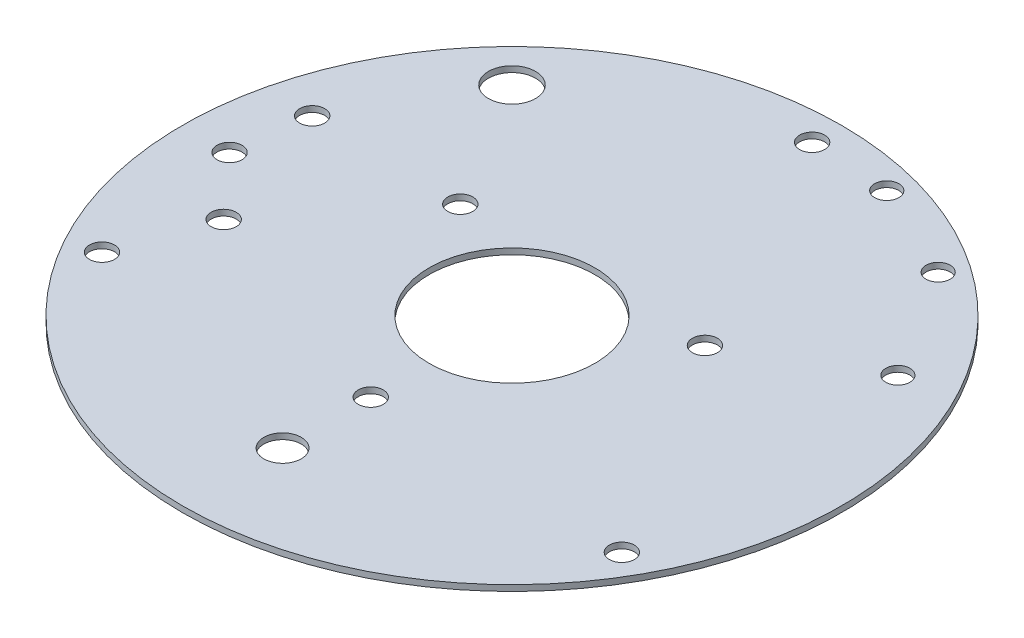
from build123d import *

# Parameters (mm, degrees)
SKETCH1_R           = 88.9
SKETCH1_R_2         = 22.352
SKETCH1_R_3         = 6.35
SKETCH1_R_4         = 5.0419
SKETCH1_R_5         = 3.3782
SKETCH1_R_6         = 3.2639
BOSS_EXTRUDE1_DEPTH = 1.6002


with BuildPart() as part:
    # Sketch1 → Boss-Extrude1 (new body)
    with BuildSketch(Plane(origin=(0, 0, 0), x_dir=(1, 0, 0), z_dir=(0, 1, 0))):
        with Locations(Location((0, 0, 0), (0, 0, 270))):
            Circle(SKETCH1_R)
        with Locations(Location((0, 0, 0), (0, 0, 270))):
            Circle(SKETCH1_R_2, mode=Mode.SUBTRACT)
        with Locations(Location((-53.8734, 53.8734, 0), (0, 0, 270))):
            Circle(SKETCH1_R_3, mode=Mode.SUBTRACT)
        with Locations(Location((0, -61.8998, 0), (0, 0, 270))):
            Circle(SKETCH1_R_4, mode=Mode.SUBTRACT)
        with Locations(Location((-61.341, -16.4338, 0), (0, 0, 270))):
            Circle(SKETCH1_R_5, mode=Mode.SUBTRACT)
        with Locations(Location((-76.2, 0, 0), (0, 0, 270))):
            Circle(SKETCH1_R_5, mode=Mode.SUBTRACT)
        with Locations(Location((-73.6092, 19.7104, 0), (0, 0, 270))):
            Circle(SKETCH1_R_5, mode=Mode.SUBTRACT)
        with Locations(Location((65.9892, 38.1, 0), (0, 0, 270))):
            Circle(SKETCH1_R_6, mode=Mode.SUBTRACT)
        with Locations(Location((47.3456, 67.6148, 0), (0, 0, 270))):
            Circle(SKETCH1_R_6, mode=Mode.SUBTRACT)
        with Locations(Location((21.3614, 79.7306, 0), (0, 0, 270))):
            Circle(SKETCH1_R_6, mode=Mode.SUBTRACT)
        with Locations(Location((0, 80.9625, 0), (0, 0, 270))):
            Circle(SKETCH1_R_5, mode=Mode.SUBTRACT)
        with Locations(Location((70.115581754, -40.48125, 0), (0, 0, 270))):
            Circle(SKETCH1_R_5, mode=Mode.SUBTRACT)
        with Locations(Location((-70.115581754, -40.48125, 0), (0, 0, 270))):
            Circle(SKETCH1_R_5, mode=Mode.SUBTRACT)
        with Locations(Location((0, -38.1, 0), (0, 0, 270))):
            Circle(SKETCH1_R_5, mode=Mode.SUBTRACT)
        with Locations(Location((-32.995567884, 19.05, 0), (0, 0, 270))):
            Circle(SKETCH1_R_5, mode=Mode.SUBTRACT)
        with Locations(Location((32.995567884, 19.05, 0), (0, 0, 270))):
            Circle(SKETCH1_R_5, mode=Mode.SUBTRACT)
    extrude(amount=BOSS_EXTRUDE1_DEPTH)


solid = part.part
